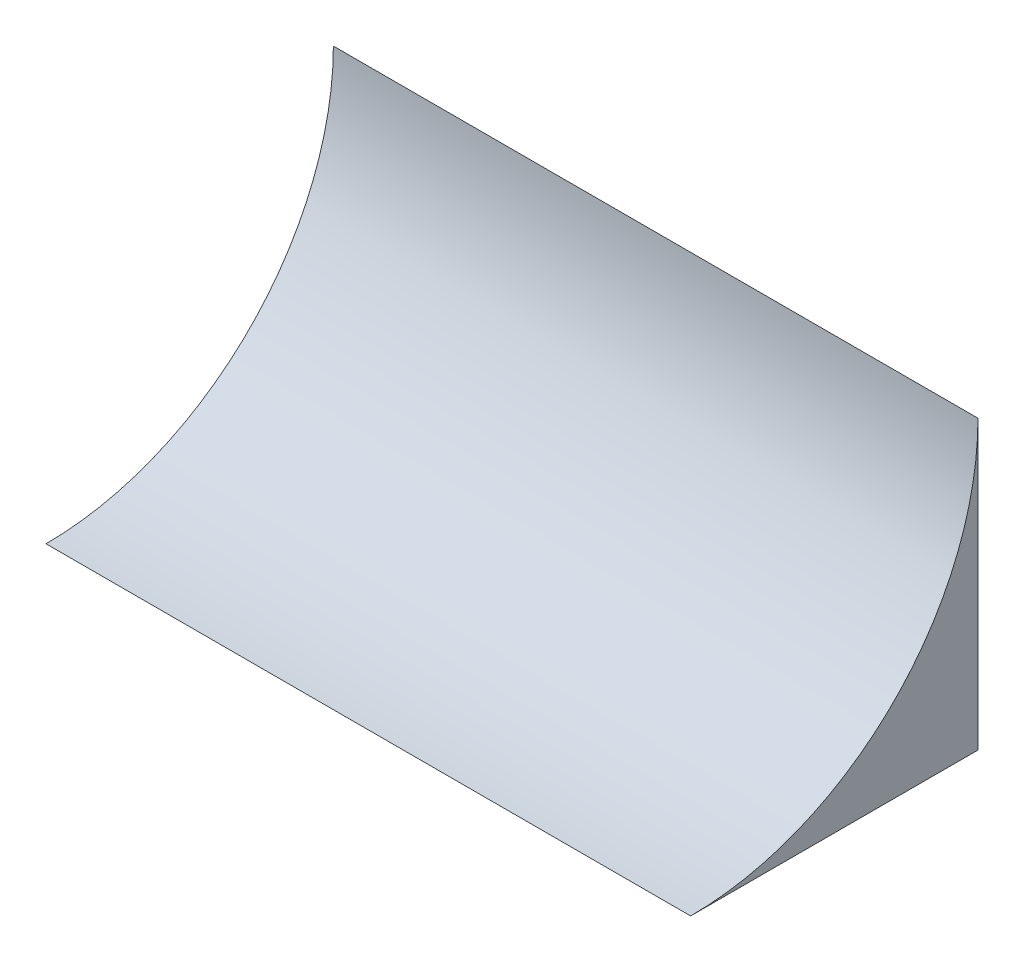
from build123d import *

# Parameters (mm, degrees)
SKETCH1_W           = 44.58
SKETCH1_H           = 44.58
BOSS_EXTRUDE1_DEPTH = 100
SKETCH2_R           = 44.58
CUT_EXTRUDE1_DEPTH  = 100


with BuildPart() as part:
    # Sketch1 → Boss-Extrude1 (new body)
    with BuildSketch(Plane(origin=(0, 0, 0), x_dir=(0, 0, -1), z_dir=(1, 0, 0))):
        Rectangle(SKETCH1_W, SKETCH1_H)
    extrude(amount=BOSS_EXTRUDE1_DEPTH)

    # Sketch2 → Cut-Extrude1 (cut)
    with BuildSketch(Plane(origin=(100, 0, 0), x_dir=(0, 0, -1), z_dir=(1, 0, 0))):
        with Locations((-22.29, 22.29)):
            Circle(SKETCH2_R)
    extrude(amount=-CUT_EXTRUDE1_DEPTH, mode=Mode.SUBTRACT)


solid = part.part
